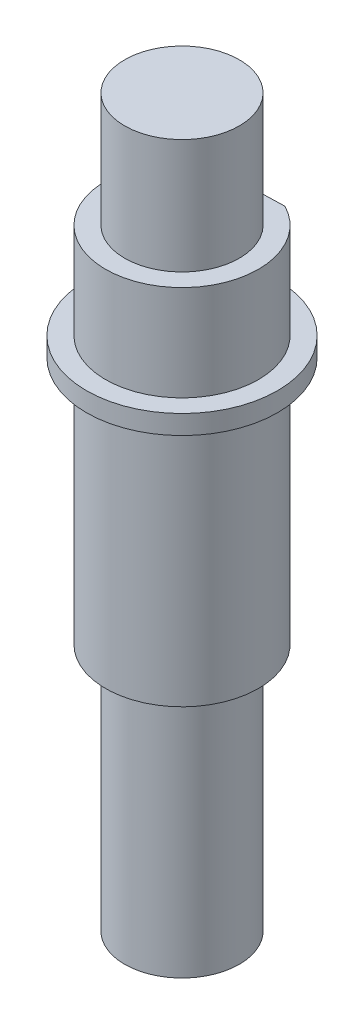
from build123d import *

# Parameters (mm, degrees)
SKETCH_1_R      = 1.5
EXTRUDE_1_DEPTH = 19
EXTRUDE_START   = 6.5
SKETCH_2_R      = 1.5
EXTRUDE_2_DEPTH = 6.5
SKETCH_3_R      = 1.5
EXTRUDE_3_DEPTH = 3
SKETCH_4_R      = 2.5
SKETCH_4_R_2    = 1.5
EXTRUDE_4_DEPTH = 0.5


with BuildPart() as part:
    # 草图1 → 凸台-拉伸1 (new body)
    with BuildSketch(Plane(origin=(0, 0, 0), x_dir=(1, 0, 0), z_dir=(0, 1, 0))):
        with Locations(Location((0, 0, 0), (0, 0, 270))):
            Circle(SKETCH_1_R)
    extrude(amount=EXTRUDE_1_DEPTH)

    # 草图2 → 凸台-拉伸2 (add)
    with BuildSketch(Plane(origin=(0, 13, 0), x_dir=(-1, 0, 0), z_dir=(0, -1, 0)).offset(EXTRUDE_START)):
        with BuildLine():
            Line((0.911921049, 1.78), (-0.911921049, 1.78))
            ThreePointArc((-0.911921049, 1.78), (0, -2), (0.911921049, 1.78))
        make_face()
        with Locations(Location((0, 0, 0), (0, 0, 90))):
            Circle(SKETCH_2_R, mode=Mode.SUBTRACT)
    extrude(amount=-EXTRUDE_2_DEPTH)

    # 草图3 → 凸台-拉伸3 (add)
    with BuildSketch(Plane(origin=(0, 13, 0), x_dir=(1, 0, 0), z_dir=(0, 1, 0))):
        with BuildLine():
            Line((0.91625301, 1.777774007), (-1.022249701, 1.719012958))
            ThreePointArc((-1.022249701, 1.719012958), (0.060597358, -1.999081779), (0.91625301, 1.777774007))
        make_face()
        with Locations(Location((0, 0, 0), (0, 0, 90))):
            Circle(SKETCH_3_R, mode=Mode.SUBTRACT)
    extrude(amount=EXTRUDE_3_DEPTH)

    # 草图4 → 凸台-拉伸4 (add)
    with BuildSketch(Plane(origin=(0, 13, 0), x_dir=(1, 0, 0), z_dir=(0, 1, 0))):
        with Locations(Location((0, 0, 0), (0, 0, 270))):
            Circle(SKETCH_4_R)
        with Locations(Location((0, 0, 0), (0, 0, 90))):
            Circle(SKETCH_4_R_2, mode=Mode.SUBTRACT)
    extrude(amount=EXTRUDE_4_DEPTH)


solid = part.part
